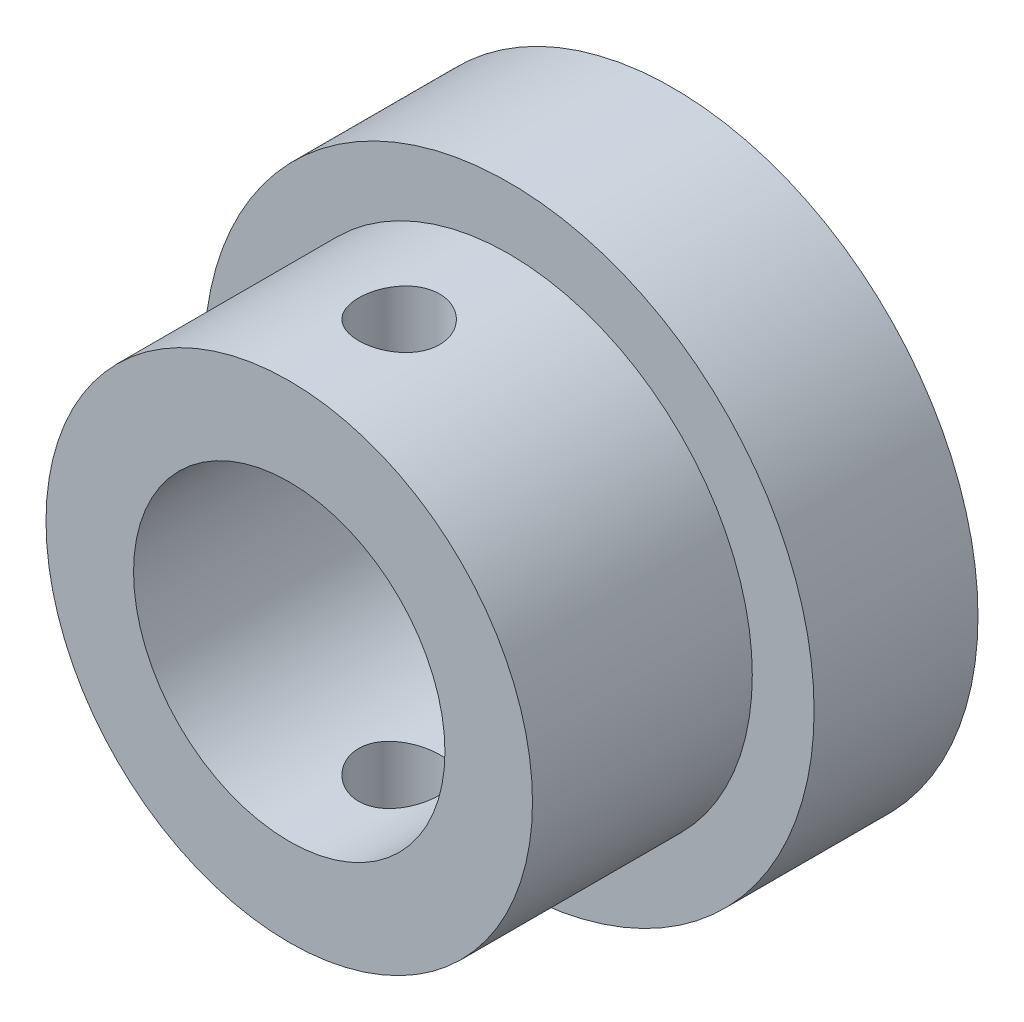
from build123d import *

# Parameters (mm, degrees)
SKETCH1_R               = 15.82
BOSS_EXTRUDE1_DEPTH     = 8.5
SKETCH2_R               = 12.615
BOSS_EXTRUDE2_DEPTH     = 11.4
SKETCH3_R               = 8.075
CUT_EXTRUDE1_DEPTH      = 30.942524944
CUT_EXTRUDE2_DEPTH      = 30.942524944
CUT_EXTRUDE2_DEPTH_BACK = 30.942524944
SKETCH4_R               = 2.1


with BuildPart() as part:
    # Sketch1 → Boss-Extrude1 (new body)
    with BuildSketch(Plane(origin=(0, 0, 0), x_dir=(0, 1, 0), z_dir=(0, 0, 1))):
        with Locations(Location((0, 0, 0), (0, 0, 270))):
            Circle(SKETCH1_R)
    extrude(amount=BOSS_EXTRUDE1_DEPTH)

    # Sketch2 → Boss-Extrude2 (add)
    with BuildSketch(Plane.XY.offset(8.5)):
        Circle(SKETCH2_R)
    extrude(amount=BOSS_EXTRUDE2_DEPTH)

    # Sketch3 → Cut-Extrude1 (cut, through all)
    with BuildSketch(Plane.XY.offset(19.9)):
        Circle(SKETCH3_R)
    extrude(amount=-CUT_EXTRUDE1_DEPTH, mode=Mode.SUBTRACT)

    # Sketch4 → Cut-Extrude2 (cut, two sides: drawn at the far end of the back side and taken through both)
    with BuildSketch(Plane(origin=(0, 0, 0), x_dir=(-1, 0, 0), z_dir=(0, 1, 0)).offset(-CUT_EXTRUDE2_DEPTH_BACK)):
        with Locations(Location((0, 14.2, 0), (0, 0, 90))):
            Circle(SKETCH4_R)
    extrude(amount=CUT_EXTRUDE2_DEPTH + CUT_EXTRUDE2_DEPTH_BACK, mode=Mode.SUBTRACT)


solid = part.part
